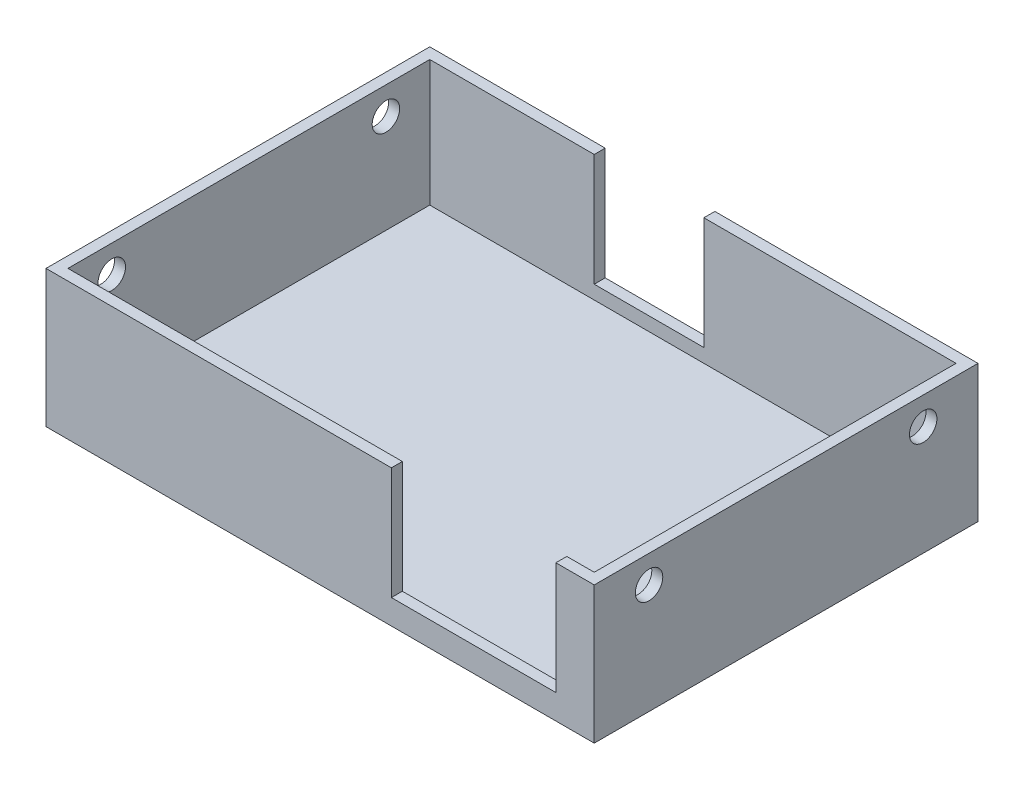
from build123d import *

# Parameters (mm, degrees)
SKETCH1_W           = 127
SKETCH1_H           = 88.9
BOSS_EXTRUDE1_DEPTH = 31.75
SHELL1_T            = -2.54
SKETCH3_R           = 3.175
CUT_EXTRUDE2_DEPTH  = 31.75
SKETCH4_W           = 38.1
SKETCH4_H           = 26.035
CUT_EXTRUDE3_DEPTH  = 31.75
SKETCH5_W           = 25.4
SKETCH5_H           = 26.035
CUT_EXTRUDE4_DEPTH  = 31.75


with BuildPart() as part:
    # Sketch1 → Boss-Extrude1 (new body)
    with BuildSketch(Plane(origin=(0, 0, 0), x_dir=(1, 0, 0), z_dir=(0, 1, 0))):
        with Locations((63.5, 44.45)):
            Rectangle(SKETCH1_W, SKETCH1_H)
    extrude(amount=BOSS_EXTRUDE1_DEPTH)

    # Shell1
    shell1_openings = [part.faces().sort_by_distance(p)[0] for p in [
        (63.5, 31.75, -44.45),
    ]]
    offset(amount=SHELL1_T, openings=shell1_openings, kind=Kind.INTERSECTION)

    # Sketch3 → Cut-Extrude2 (cut)
    with BuildSketch(Plane(origin=(127, 0, 0), x_dir=(0, 0, -1), z_dir=(1, 0, 0))):
        with Locations((12.7, 25.4)):
            Circle(SKETCH3_R)
        with Locations((76.2, 25.4)):
            Circle(SKETCH3_R)
    cut_extrude2 = extrude(amount=-CUT_EXTRUDE2_DEPTH, mode=Mode.SUBTRACT)

    # Mirror2: Cut-Extrude2 across plane
    add(cut_extrude2.mirror(Plane(origin=(63.5, 0, 0), x_dir=(0, 0, 1), z_dir=(1, 0, 0))), mode=Mode.SUBTRACT)

    # Sketch4 → Cut-Extrude3 (cut)
    with BuildSketch(Plane.XY):
        with Locations((99.06, 18.7325)):
            Rectangle(SKETCH4_W, SKETCH4_H)
    extrude(amount=-CUT_EXTRUDE3_DEPTH, mode=Mode.SUBTRACT)

    # Sketch5 → Cut-Extrude4 (cut)
    with BuildSketch(Plane(origin=(0, 0, -88.9), x_dir=(-1, 0, 0), z_dir=(0, 0, -1))):
        with Locations((-53.34, 18.7325)):
            Rectangle(SKETCH5_W, SKETCH5_H)
    extrude(amount=-CUT_EXTRUDE4_DEPTH, mode=Mode.SUBTRACT)


solid = part.part
